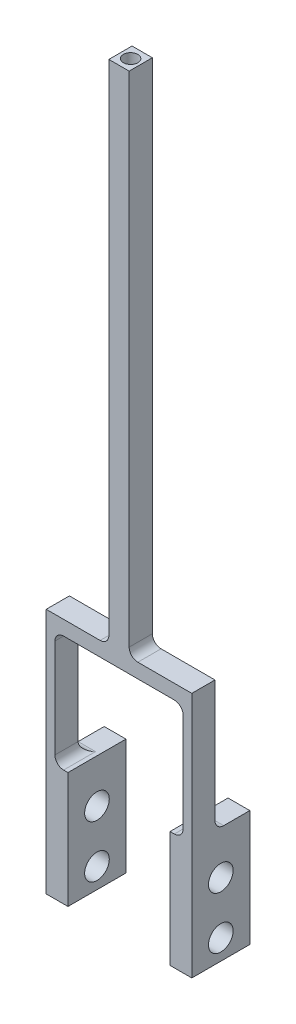
from build123d import *

# Parameters (mm, degrees)
BOSS_EXTRUDE4_DEPTH     = 10
CUT_EXTRUDE2_DEPTH      = 262.400095639
CUT_EXTRUDE2_DEPTH_BACK = 262.400095639
SKETCH7_R               = 4.25
CUT_EXTRUDE4_DEPTH      = 262.400095639
CUT_EXTRUDE4_DEPTH_BACK = 262.400095639
SKETCH11_W              = 18.643899753
SKETCH11_H              = 220
CUT_EXTRUDE5_DEPTH      = 262.400095639
CUT_EXTRUDE5_DEPTH_BACK = 20
SKETCH12_R              = 2.5
FILLET3_R               = 3


with BuildPart() as part:
    # Sketch6 → Boss-Extrude4 (new, symmetric)
    with BuildSketch(Plane.XY):
        Polygon((-25.1, 0), (-17.6, 0), (-17.6, 40), (-22.1, 40), (-22.1, 80), (22.1, 80), (22.1, 40), (17.6, 40), (17.6, 0), (25.1, 0), (25.1, 85), (3.5, 85), (3.5, 260), (-3.5, 260), (-3.5, 85), (-25.1, 85), align=None)
    extrude(amount=BOSS_EXTRUDE4_DEPTH, both=True)

    # Sketch7 → Cut-Extrude2 (cut, two sides: drawn at the far end of the back side and taken through both)
    with BuildSketch(Plane(origin=(0, 0, 0), x_dir=(0, 0, -1), z_dir=(1, 0, 0)).offset(-CUT_EXTRUDE2_DEPTH_BACK)):
        with Locations((0, 7)):
            Circle(SKETCH7_R)
        with Locations((0, 25)):
            Circle(SKETCH7_R)
    extrude(amount=CUT_EXTRUDE2_DEPTH + CUT_EXTRUDE2_DEPTH_BACK, mode=Mode.SUBTRACT)

    # Sketch11 → Cut-Extrude4 (cut, two sides: drawn at the far end of the back side and taken through both)
    with BuildSketch(Plane(origin=(0, 0, 0), x_dir=(0, 0, -1), z_dir=(1, 0, 0)).offset(-CUT_EXTRUDE4_DEPTH_BACK)):
        with Locations((7.321949876, 150)):
            Rectangle(SKETCH11_W, SKETCH11_H)
    extrude(amount=CUT_EXTRUDE4_DEPTH + CUT_EXTRUDE4_DEPTH_BACK, mode=Mode.SUBTRACT)

    # Sketch12 → Cut-Extrude5 (cut, two sides: drawn at the far end of the back side and taken through both)
    with BuildSketch(Plane(origin=(0, 260, 0), x_dir=(1, 0, 0), z_dir=(0, 1, 0)).offset(-CUT_EXTRUDE5_DEPTH_BACK)):
        with Locations(Location((0, -6, 0), (0, 0, 90))):
            Circle(SKETCH12_R)
    extrude(amount=CUT_EXTRUDE5_DEPTH + CUT_EXTRUDE5_DEPTH_BACK, mode=Mode.SUBTRACT)

    # Fillet3
    fillet3_edges = [part.edges().sort_by_distance(p)[0] for p in [
        (-23.6, 40, 2),
        (23.6, 40, 2),
        (22.1, 40, 6),
        (22.1, 80, 6),
        (-22.1, 80, 6),
        (-22.1, 40, 6),
        (-3.5, 85, 6),
        (3.5, 85, 6),
    ]]
    fillet(fillet3_edges, radius=FILLET3_R)


solid = part.part
